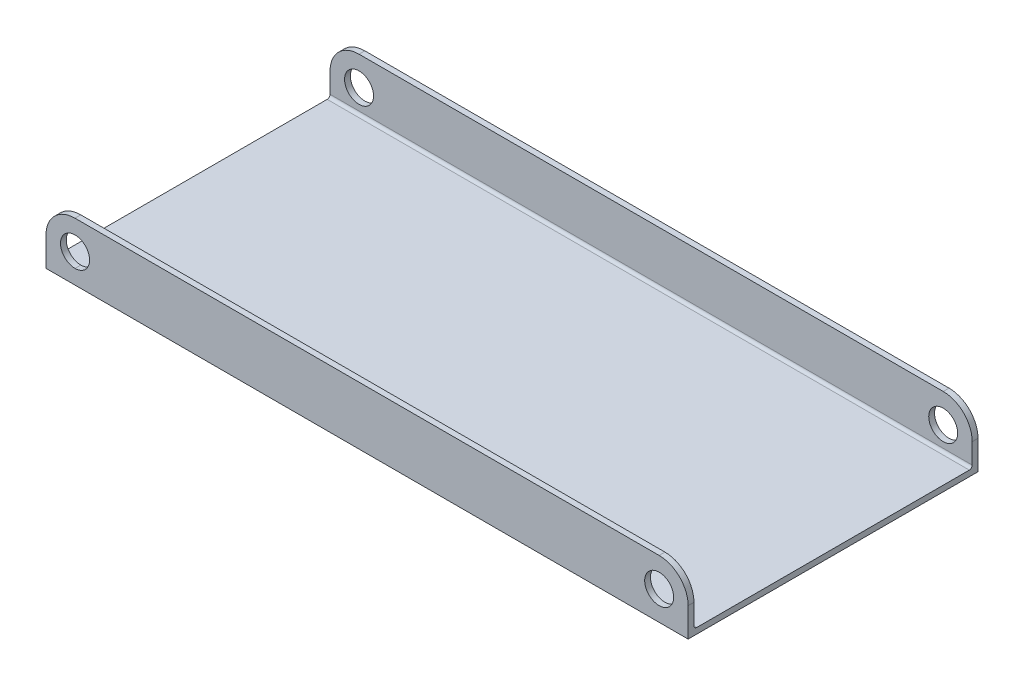
from build123d import *

# Parameters (mm, degrees)
SKETCH1_W           = 140.676923077
SKETCH1_H           = 1.27
BOSS_EXTRUDE1_DEPTH = 12.7
SKETCH1_3_W         = 140.676923077
SKETCH1_3_H         = 60.96
BOSS_EXTRUDE2_DEPTH = 1.27
SKETCH2_R           = 3.175
CUT_EXTRUDE1_DEPTH  = 508
SKETCH1_5_W         = 140.676923077
SKETCH1_5_H         = 1.27
BOSS_EXTRUDE3_DEPTH = 12.7
SKETCH3_R           = 3.175
CUT_EXTRUDE2_DEPTH  = 12.7
FILLET1_R           = 6.35
FILLET2_R           = 0.635
SKETCH3_2_R         = 3.175
CUT_EXTRUDE3_DEPTH  = 155.866189617


with BuildPart() as part:
    # Sketch1 → Boss-Extrude1 (new body)
    with BuildSketch(Plane(origin=(0, 0, 0), x_dir=(1, 0, 0), z_dir=(0, 1, 0))):
        with Locations((70.338461538, 0.635)):
            Rectangle(SKETCH1_W, SKETCH1_H)
    extrude(amount=BOSS_EXTRUDE1_DEPTH)

    # Sketch1<3> → Boss-Extrude2 (add)
    with BuildSketch(Plane(origin=(0, 0, 0), x_dir=(1, 0, 0), z_dir=(0, 1, 0))):
        with Locations((70.338461538, 31.75)):
            Rectangle(SKETCH1_3_W, SKETCH1_3_H)
    extrude(amount=BOSS_EXTRUDE2_DEPTH)

    # Sketch2 → Cut-Extrude1 (cut)
    with BuildSketch(Plane.XY):
        with Locations((6.37364392, 6.35)):
            Circle(SKETCH2_R)
        with Locations((146.05, 6.35)):
            Circle(SKETCH2_R)
    extrude(amount=-CUT_EXTRUDE1_DEPTH, mode=Mode.SUBTRACT)

    # Sketch1<5> → Boss-Extrude3 (add)
    with BuildSketch(Plane(origin=(0, 0, 0), x_dir=(1, 0, 0), z_dir=(0, 1, 0))):
        with Locations((70.338461538, 62.865)):
            Rectangle(SKETCH1_5_W, SKETCH1_5_H)
    extrude(amount=BOSS_EXTRUDE3_DEPTH)

    # Sketch3 → Cut-Extrude2 (cut)
    with BuildSketch(Plane(origin=(0, 0, -63.5), x_dir=(-1, 0, 0), z_dir=(0, 0, -1))):
        with Locations((-6.35, 6.35)):
            Circle(SKETCH3_R)
        with Locations((-146.05, 6.35)):
            Circle(SKETCH3_R)
        with Locations((-134.326923077, 6.35)):
            Circle(SKETCH3_R)
    extrude(amount=-CUT_EXTRUDE2_DEPTH, mode=Mode.SUBTRACT)

    # Fillet1
    fillet1_edges = [part.edges().sort_by_distance(p)[0] for p in [
        (0, 12.7, -0.635),
        (140.676923077, 12.7, -0.635),
        (140.676923077, 12.7, -62.865),
        (0, 12.7, -62.865),
    ]]
    fillet(fillet1_edges, radius=FILLET1_R)

    # Fillet2
    fillet2_edges = [part.edges().sort_by_distance(p)[0] for p in [
        (70.338461538, 1.27, -1.27),
        (70.338461538, 1.27, -62.23),
    ]]
    fillet(fillet2_edges, radius=FILLET2_R)

    # Sketch3<2> → Cut-Extrude3 (cut, through all)
    with BuildSketch(Plane(origin=(0, 0, -63.5), x_dir=(-1, 0, 0), z_dir=(0, 0, -1))):
        with Locations((-6.35, 6.35)):
            Circle(SKETCH3_2_R)
        with Locations((-146.05, 6.35)):
            Circle(SKETCH3_2_R)
        with Locations((-134.326923077, 6.35)):
            Circle(SKETCH3_2_R)
    extrude(amount=-CUT_EXTRUDE3_DEPTH, mode=Mode.SUBTRACT)


solid = part.part
